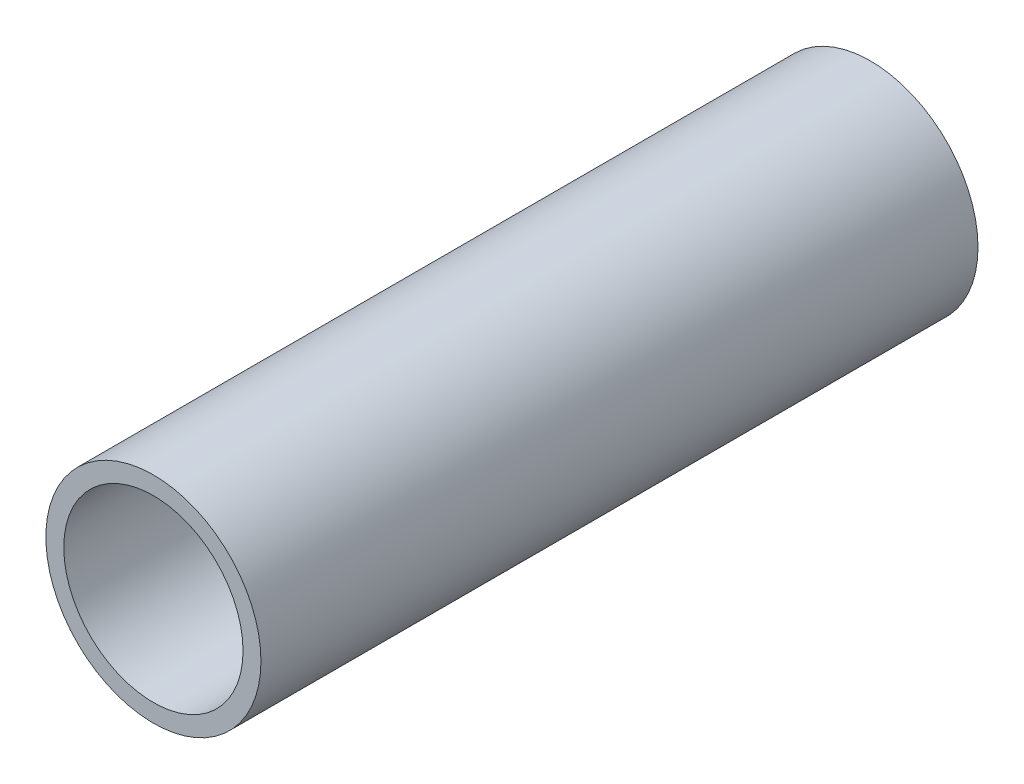
from build123d import *

# Parameters (mm, degrees)
SKETCH1_R           = 15
SKETCH1_R_2         = 12.5
BOSS_EXTRUDE1_DEPTH = 100


with BuildPart() as part:
    # Sketch1 → Boss-Extrude1 (new body)
    with BuildSketch(Plane.XY):
        Circle(SKETCH1_R)
        Circle(SKETCH1_R_2, mode=Mode.SUBTRACT)
    extrude(amount=BOSS_EXTRUDE1_DEPTH)


solid = part.part
